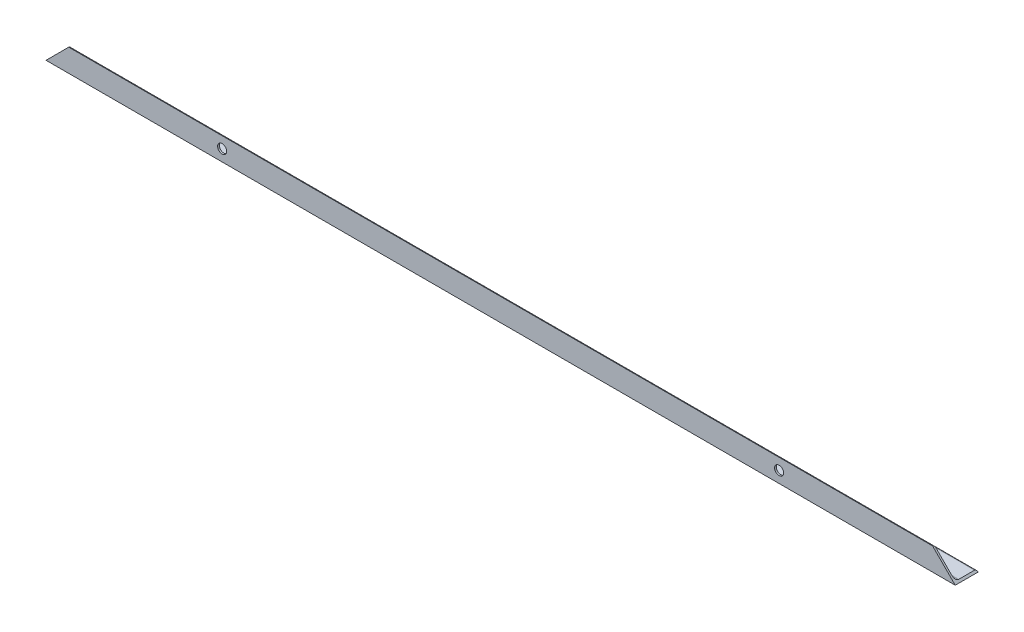
from build123d import *

# Parameters (mm, degrees)
L_ANGLE_EQUAL_40X40X3_5_DEPTH = 1600
SKETCH14_R                    = 8
CUT_EXTRUDE1_DEPTH            = 1601.999687695


with BuildPart() as part:
    # Sketch13 → L angle (equal) 40X40X3(5) (new body)
    with BuildSketch(Plane(origin=(0, 0, 0), x_dir=(0, 0, -1), z_dir=(1, 0, 0))):
        with BuildLine():
            Line((0, 40), (0, 0))
            Line((0, 0), (40, 0))
            ThreePointArc((40, 0), (39.121320344, 2.121320344), (37, 3))
            Line((37, 3), (9, 3))
            ThreePointArc((9, 3), (4.757359313, 4.757359313), (3, 9))
            Line((3, 9), (3, 37))
            ThreePointArc((3, 37), (2.121320344, 39.121320344), (0, 40))
        make_face()
    extrude(amount=L_ANGLE_EQUAL_40X40X3_5_DEPTH)

    # Sketch14 → Cut-Extrude1 (cut, through all)
    with BuildSketch(Plane.XY):
        with Locations((310, 20)):
            Circle(SKETCH14_R)
        with Locations((1290, 20)):
            Circle(SKETCH14_R)
        Polygon((1600, 0), (1600, 40), (1560, 40), align=None)
        Polygon((0, 40), (0, 0), (40, 40), align=None)
    extrude(amount=-CUT_EXTRUDE1_DEPTH, mode=Mode.SUBTRACT)


solid = part.part
